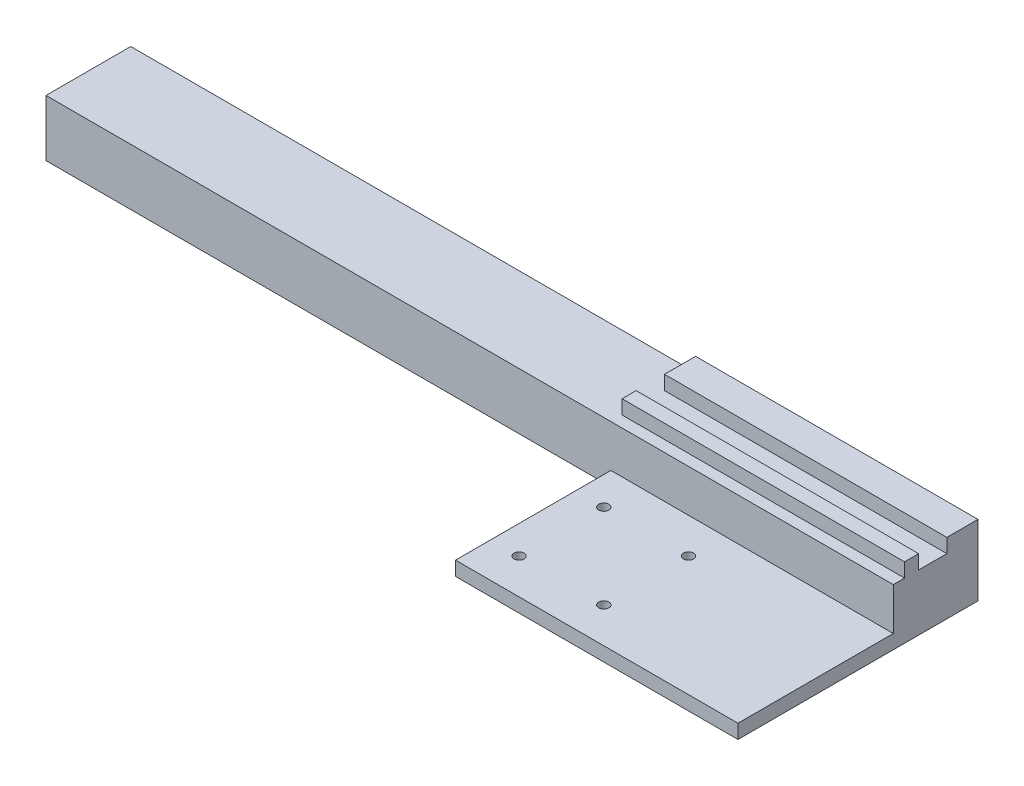
from build123d import *

# Parameters (mm, degrees)
SKETCH1_W                                        = 100
SKETCH1_H                                        = 55
BOSS_EXTRUDE1_DEPTH                              = 5
CBORE_FOR_M3_PAN_HEAD_MACHINE_SCREW1_D           = 3.6
CBORE_FOR_M3_PAN_HEAD_MACHINE_SCREW1_CBORE_D     = 7
CBORE_FOR_M3_PAN_HEAD_MACHINE_SCREW1_CBORE_DEPTH = 2.4
MIRROR1_AT_THE_SECOND_PLANE_COPY_1_D             = 3.6
MIRROR1_AT_THE_SECOND_PLANE_COPY_1_CBORE_D       = 7
MIRROR1_AT_THE_SECOND_PLANE_COPY_1_CBORE_DEPTH   = 2.4
BOSS_EXTRUDE3_DEPTH                              = 15
BOSS_EXTRUDE3_DEPTH_BACK                         = 5
SKETCH11_W                                       = 100
SKETCH11_H                                       = 11.02
SKETCH11_H_2                                     = 5
BOSS_EXTRUDE5_DEPTH                              = 5


with BuildPart() as part:
    # Sketch1 → Boss-Extrude1 (new body)
    with BuildSketch(Plane(origin=(0, 0, 0), x_dir=(1, 0, 0), z_dir=(0, 1, 0))):
        with Locations((50, -27.5)):
            Rectangle(SKETCH1_W, SKETCH1_H)
    extrude(amount=BOSS_EXTRUDE1_DEPTH)

    # CBORE for M3 Pan Head Machine Screw1 (through all)
    with Locations(Plane(origin=(0, 0, 0), x_dir=(-1, 0, 0), z_dir=(0, -1, 0))):
        with Locations((-10, -12.5)):
            cbore_for_m3_pan_head_machine_screw1 = CounterBoreHole(CBORE_FOR_M3_PAN_HEAD_MACHINE_SCREW1_D / 2, CBORE_FOR_M3_PAN_HEAD_MACHINE_SCREW1_CBORE_D / 2, CBORE_FOR_M3_PAN_HEAD_MACHINE_SCREW1_CBORE_DEPTH)

    # Mirror1: CBORE for M3 Pan Head Machine Screw1 across plane
    add(cbore_for_m3_pan_head_machine_screw1.mirror(Plane.XY.offset(27.5)), mode=Mode.SUBTRACT)

    # Mirror1 at the second plane: CBORE for M3 Pan Head Machine Screw1 across plane
    add(cbore_for_m3_pan_head_machine_screw1.mirror(Plane.ZY.offset(-25)), mode=Mode.SUBTRACT)

    # Mirror1 at the second plane copy 1 (through all)
    with Locations(Plane(origin=(50, 0, 55), x_dir=(1, 0, 0), z_dir=(0, -1, 0))):
        with Locations((-10, -12.5)):
            CounterBoreHole(MIRROR1_AT_THE_SECOND_PLANE_COPY_1_D / 2, MIRROR1_AT_THE_SECOND_PLANE_COPY_1_CBORE_D / 2, MIRROR1_AT_THE_SECOND_PLANE_COPY_1_CBORE_DEPTH)

    # Sketch9 → Boss-Extrude3 (add, two sides: drawn at the far end of the back side and taken through both)
    with BuildSketch(Plane(origin=(0, 5, 0), x_dir=(1, 0, 0), z_dir=(0, 1, 0)).offset(-BOSS_EXTRUDE3_DEPTH_BACK)):
        Polygon((-200, 0), (50, 0), (100, 0), (100, 30), (-200, 30), align=None)
    extrude(amount=BOSS_EXTRUDE3_DEPTH + BOSS_EXTRUDE3_DEPTH_BACK)

    # Sketch11 → Boss-Extrude5 (add)
    with BuildSketch(Plane(origin=(0, 20, 0), x_dir=(1, 0, 0), z_dir=(0, 1, 0))):
        with Locations((50, 24.49)):
            Rectangle(SKETCH11_W, SKETCH11_H)
        with Locations((50, 6.48)):
            Rectangle(SKETCH11_W, SKETCH11_H_2)
    extrude(amount=BOSS_EXTRUDE5_DEPTH)


solid = part.part
